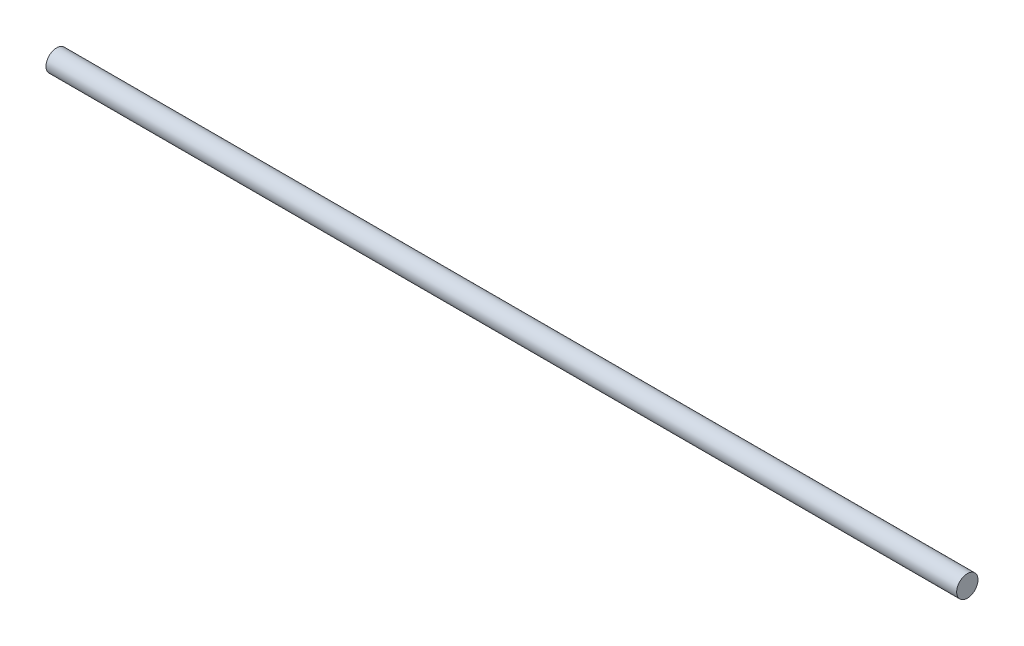
from build123d import *

# Parameters (mm, degrees)
SKETCH1_R           = 4.7625
BOSS_EXTRUDE1_DEPTH = 406.4


with BuildPart() as part:
    # Sketch1 → Boss-Extrude1 (new body)
    with BuildSketch(Plane(origin=(0, 0, 0), x_dir=(0, 0, -1), z_dir=(1, 0, 0))):
        Circle(SKETCH1_R)
    extrude(amount=BOSS_EXTRUDE1_DEPTH)


solid = part.part
